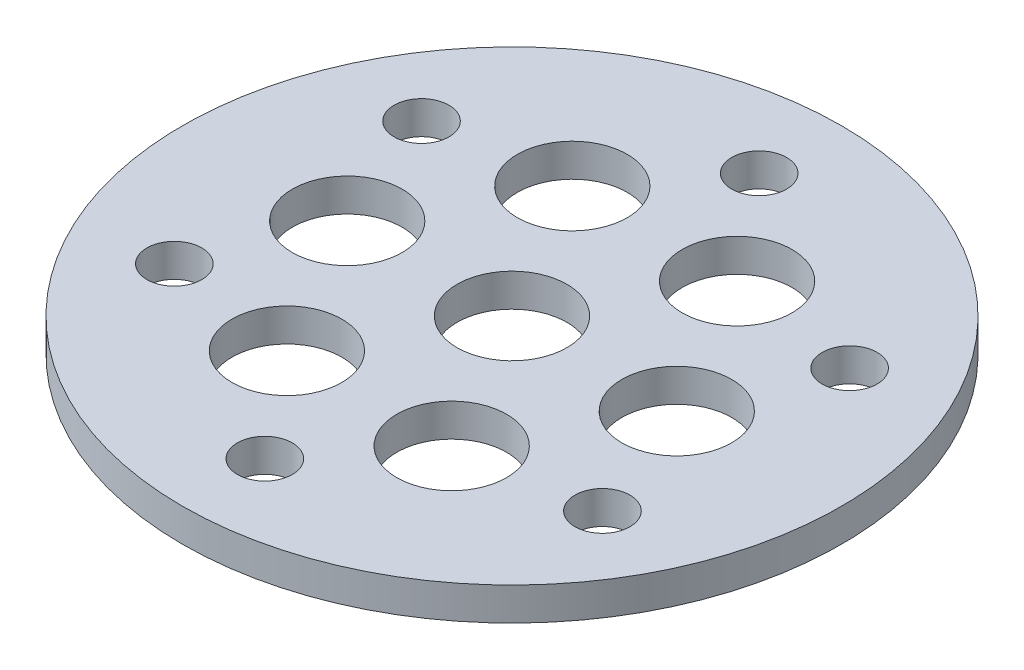
from build123d import *

# Parameters (mm, degrees)
SKETCH_1_R      = 30
SKETCH_1_R_2    = 5
SKETCH_1_R_3    = 2.5
EXTRUDE_1_DEPTH = 3


with BuildPart() as part:
    # 草图1 → 凸台-拉伸1 (new body)
    with BuildSketch(Plane(origin=(0, 0, 0), x_dir=(1, 0, 0), z_dir=(0, 1, 0))):
        with Locations(Location((0, 0, 0), (0, 0, 270))):
            Circle(SKETCH_1_R)
        with Locations(Location((0, 0, 0), (0, 0, 270))):
            Circle(SKETCH_1_R_2, mode=Mode.SUBTRACT)
        with Locations(Location((0, 22.5, 0), (0, 0, 270))):
            Circle(SKETCH_1_R_3, mode=Mode.SUBTRACT)
        with Locations(Location((19.485571585, 11.25, 0), (0, 0, 270))):
            Circle(SKETCH_1_R_3, mode=Mode.SUBTRACT)
        with Locations(Location((19.485571585, -11.25, 0), (0, 0, 270))):
            Circle(SKETCH_1_R_3, mode=Mode.SUBTRACT)
        with Locations(Location((0, -22.5, 0), (0, 0, 270))):
            Circle(SKETCH_1_R_3, mode=Mode.SUBTRACT)
        with Locations(Location((-19.485571585, -11.25, 0), (0, 0, 270))):
            Circle(SKETCH_1_R_3, mode=Mode.SUBTRACT)
        with Locations(Location((-19.485571585, 11.25, 0), (0, 0, 270))):
            Circle(SKETCH_1_R_3, mode=Mode.SUBTRACT)
        with Locations(Location((-7.5, 12.990381057, 0), (0, 0, 270))):
            Circle(SKETCH_1_R_2, mode=Mode.SUBTRACT)
        with Locations(Location((7.5, 12.990381057, 0), (0, 0, 270))):
            Circle(SKETCH_1_R_2, mode=Mode.SUBTRACT)
        with Locations(Location((15, 0, 0), (0, 0, 270))):
            Circle(SKETCH_1_R_2, mode=Mode.SUBTRACT)
        with Locations(Location((7.5, -12.990381057, 0), (0, 0, 270))):
            Circle(SKETCH_1_R_2, mode=Mode.SUBTRACT)
        with Locations(Location((-7.5, -12.990381057, 0), (0, 0, 270))):
            Circle(SKETCH_1_R_2, mode=Mode.SUBTRACT)
        with Locations(Location((-15, 0, 0), (0, 0, 270))):
            Circle(SKETCH_1_R_2, mode=Mode.SUBTRACT)
    extrude(amount=EXTRUDE_1_DEPTH)


solid = part.part
